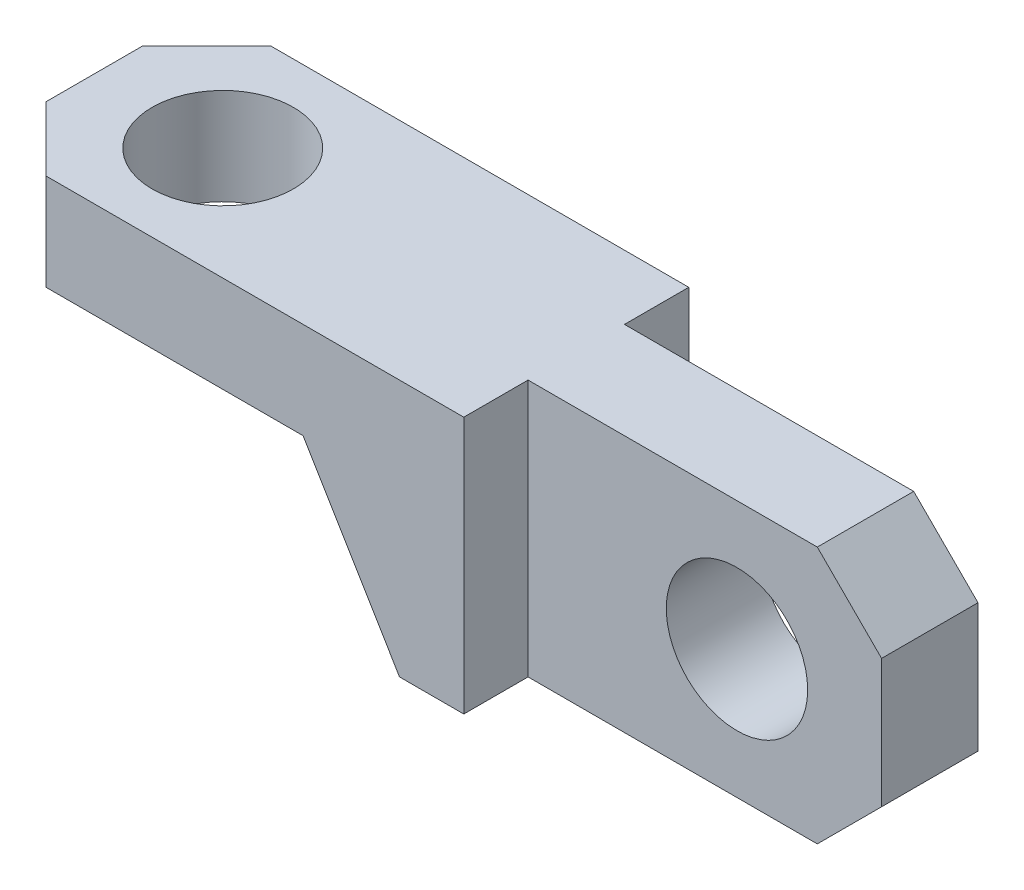
from build123d import *

# Parameters (mm, degrees)
SKETCH1_R            = 2.794
BASE_DEPTH           = 10.16
LATCH_HOLE_REACH     = 37.126
SKETCH2_R            = 2.794
SERVO_ARM_HOLE_REACH = 37.673
CHAMFER1_SIZE        = 2.54


with BuildPart() as part:
    # Sketch1 → base (new body)
    with BuildSketch(Plane(origin=(0, 0, 0), x_dir=(1, 0, 0), z_dir=(0, 1, 0))):
        Polygon((0, 0), (19.05, 0), (19.05, 2.54), (33.02, 2.54), (33.02, 6.35), (19.05, 6.35), (19.05, 8.89), (0, 8.89), align=None)
        with Locations(Location((5.08, 4.445, 0), (0, 0, 270))):
            Circle(SKETCH1_R, mode=Mode.SUBTRACT)
    extrude(amount=BASE_DEPTH)

    # Sketch2 → latch_hole (cut, up to next)
    with BuildSketch(Plane.XY.offset(-2.54), mode=Mode.PRIVATE) as latch_hole_sk1:
        with Locations((27.305, 5.08)):
            Circle(SKETCH2_R)
    latch_hole_tool1 = extrude(latch_hole_sk1.sketch, amount=-LATCH_HOLE_REACH, mode=Mode.PRIVATE) & part.part
    add(latch_hole_tool1.solids().sort_by_distance((27.305, 5.08, -2.54))[0], mode=Mode.SUBTRACT)

    # Sketch4 → servo_arm_hole (cut, up to next)
    with BuildSketch(Plane.XY, mode=Mode.PRIVATE) as servo_arm_hole_sk1:
        Polygon((0, 6.35), (12.7, 6.35), (16.51, 0), (0, 0), align=None)
    servo_arm_hole_tool1 = extrude(servo_arm_hole_sk1.sketch, amount=-SERVO_ARM_HOLE_REACH, mode=Mode.PRIVATE) & part.part
    add(servo_arm_hole_tool1.solids().sort_by_distance((7.343913, 3.036957, 0))[0], mode=Mode.SUBTRACT)

    # Chamfer1
    chamfer1_edges = [part.edges().sort_by_distance(p)[0] for p in [
        (0, 8.255, -8.89),
        (0, 8.255, 0),
        (33.02, 10.16, -4.445),
        (33.02, 0, -4.445),
    ]]
    chamfer(chamfer1_edges, length=CHAMFER1_SIZE)


solid = part.part
